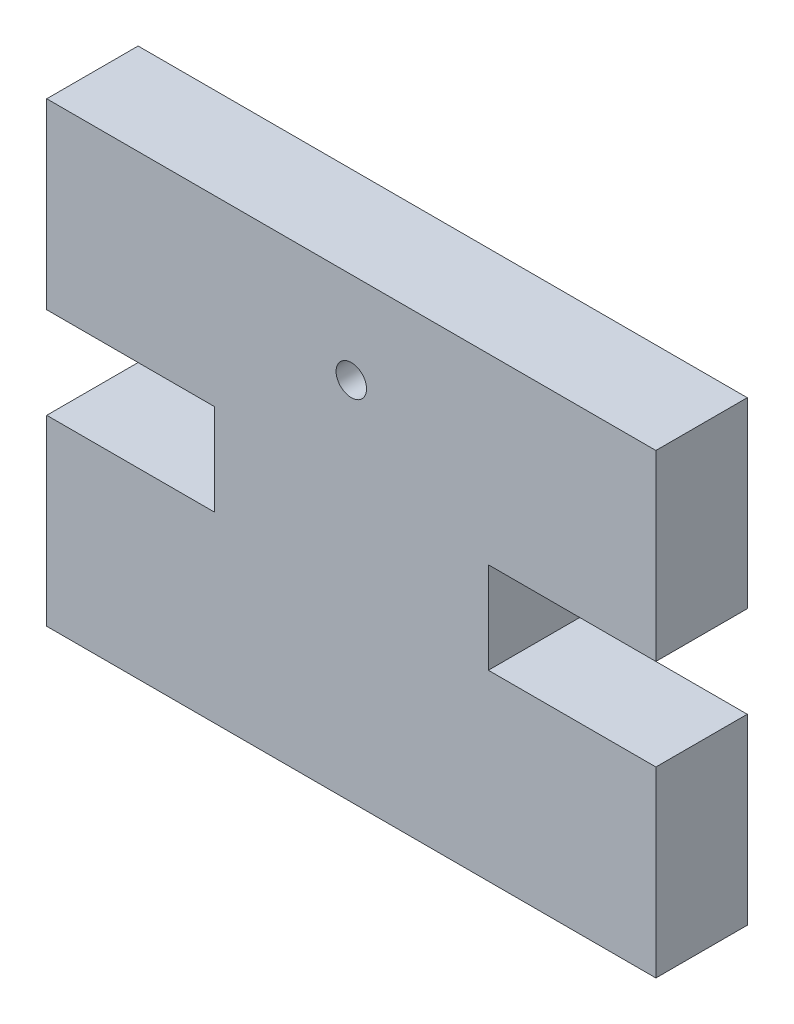
from build123d import *

# Parameters (mm, degrees)
SKETCH1_R           = 0.5
BOSS_EXTRUDE1_DEPTH = 3
SKETCH2_W           = 20
SKETCH2_H           = 3
BOSS_EXTRUDE2_DEPTH = 6


with BuildPart() as part:
    # Sketch1 → Boss-Extrude1 (new body)
    with BuildSketch(Plane.XY):
        Polygon((0, 0), (9, 0), (9, 3), (14.5, 3), (14.5, 9), (-5.5, 9), (-5.5, 3), (0, 3), align=None)
        with Locations((4.5, 6)):
            Circle(SKETCH1_R, mode=Mode.SUBTRACT)
    extrude(amount=BOSS_EXTRUDE1_DEPTH)

    # Sketch2 → Boss-Extrude2 (add)
    with BuildSketch(Plane.XZ):
        with Locations((4.5, 1.5)):
            Rectangle(SKETCH2_W, SKETCH2_H)
    extrude(amount=BOSS_EXTRUDE2_DEPTH)


solid = part.part
